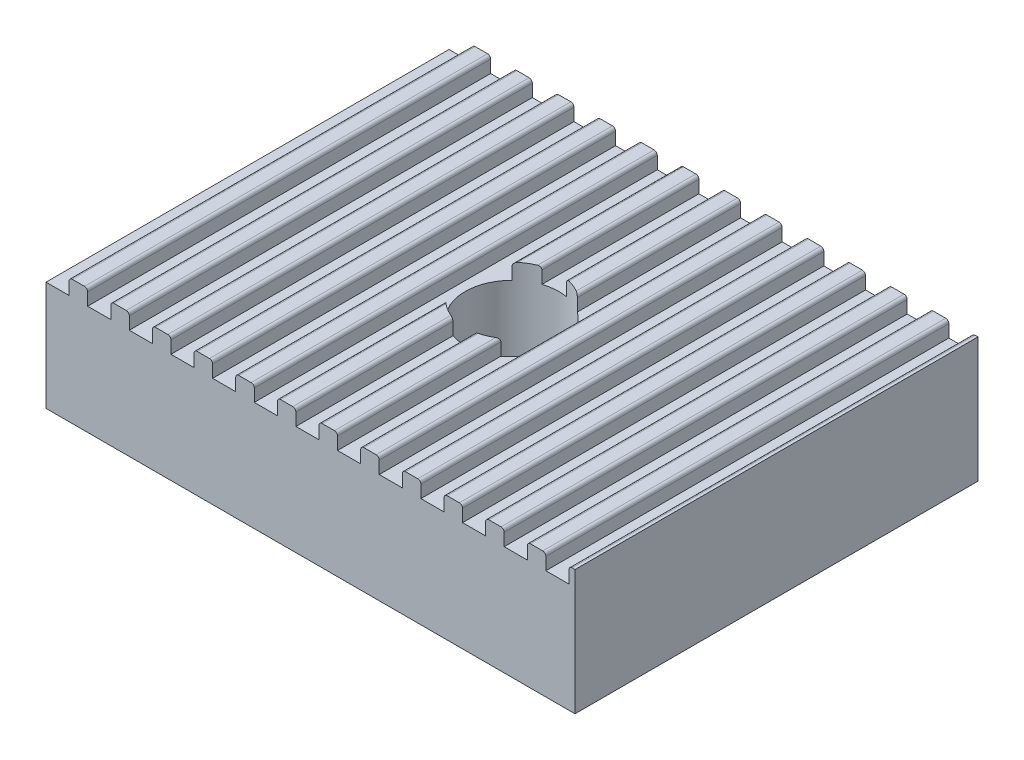
from build123d import *

# Parameters (mm, degrees)
SKETCH1_W            = 25.4
SKETCH1_H            = 19.35
BOSS_EXTRUDE1_DEPTH  = 6
SKETCH2_W            = 1.11
SKETCH2_H            = 0.75
CUT_EXTRUDE3_DEPTH   = 24.910510241
LPATTERN2_COUNT      = 13
LPATTERN2_PITCH      = 2
FILLET1_R            = 0.15
M4_CLEARANCE_HOLE1_D = 4.5


with BuildPart() as part:
    # Sketch1 → Boss-Extrude1 (new body)
    with BuildSketch(Plane(origin=(0, 0, 0), x_dir=(1, 0, 0), z_dir=(0, 1, 0))):
        Rectangle(SKETCH1_W, SKETCH1_H)
    extrude(amount=BOSS_EXTRUDE1_DEPTH)

    # Sketch2 → Cut-Extrude3 (cut, through all)
    with BuildSketch(Plane.XY.offset(9.675)):
        with Locations((-12.145, 5.625)):
            Rectangle(SKETCH2_W, SKETCH2_H)
    cut_extrude3 = extrude(amount=-CUT_EXTRUDE3_DEPTH, mode=Mode.SUBTRACT)

    # LPattern2: Cut-Extrude3 ×13
    with Locations(*[(i * LPATTERN2_PITCH, 0, 0) for i in range(1, LPATTERN2_COUNT)]):
        add(cut_extrude3, mode=Mode.SUBTRACT)

    # Fillet1
    fillet1_edges = [part.edges().sort_by_distance(p)[0] for p in [
        (-6.7, 6, 0),
        (-5.59, 6, 0),
        (-4.7, 6, 0),
        (-3.59, 6, 0),
        (-2.7, 6, 0),
        (-1.59, 6, 0),
        (-0.7, 6, 0),
        (0.41, 6, 0),
        (1.3, 6, 0),
        (2.41, 6, 0),
        (3.3, 6, 0),
        (4.41, 6, 0),
        (5.3, 6, 0),
        (6.41, 6, 0),
        (7.3, 6, 0),
        (8.41, 6, 0),
        (9.3, 6, 0),
        (10.41, 6, 0),
        (11.3, 6, 0),
        (12.41, 6, 0),
        (-11.59, 6, 0),
        (-10.7, 6, 0),
        (-9.59, 6, 0),
        (-8.7, 6, 0),
        (-7.59, 6, 0),
    ]]
    fillet(fillet1_edges, radius=FILLET1_R)

    # M4 Clearance Hole1 (through all)
    with Locations(Plane(origin=(0, 0, 0), x_dir=(-1, 0, 0), z_dir=(0, -1, 0))):
        with Locations((0, 0)):
            Hole(M4_CLEARANCE_HOLE1_D / 2)


solid = part.part
